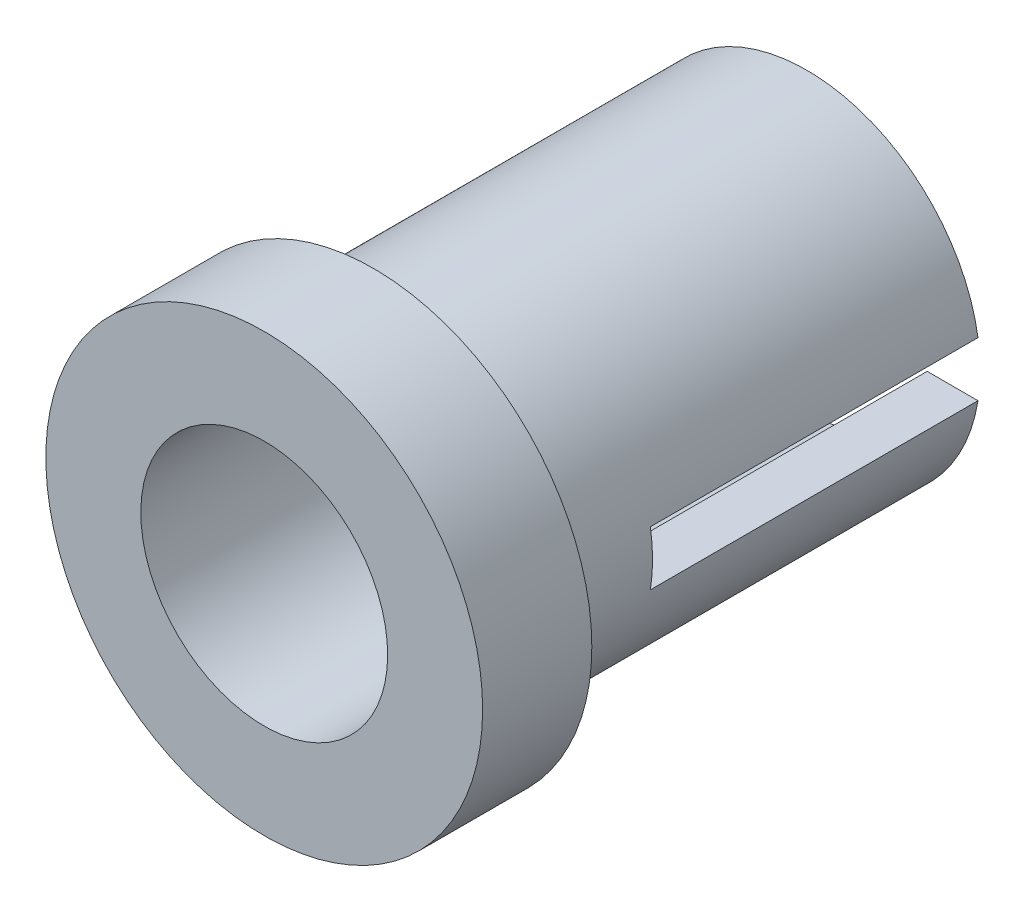
from build123d import *

# Parameters (mm, degrees)
SKETCH1_R           = 1.5875
SKETCH1_R_2         = 1.1303
BOSS_EXTRUDE1_DEPTH = 3.96875
SKETCH2_R           = 2
SKETCH2_R_2         = 1.5875
SKETCH2_R_3         = 1.1303
BOSS_EXTRUDE2_DEPTH = 1
SKETCH3_W           = 4.285117224
SKETCH3_H           = 0.5
CUT_EXTRUDE1_DEPTH  = 3


with BuildPart() as part:
    # Sketch1 → Boss-Extrude1 (new body)
    with BuildSketch(Plane.XY):
        Circle(SKETCH1_R)
        Circle(SKETCH1_R_2, mode=Mode.SUBTRACT)
    extrude(amount=BOSS_EXTRUDE1_DEPTH)

    # Sketch2 → Boss-Extrude2 (add)
    # profile 1 of 2: a face of its own
    with BuildSketch(Plane.XY.offset(3.96875)):
        Circle(SKETCH2_R)
        Circle(SKETCH2_R_2, mode=Mode.SUBTRACT)
    # profile 2 of 2: a face of its own
    with BuildSketch(Plane.XY.offset(3.96875)):
        Circle(SKETCH2_R_2)
        Circle(SKETCH2_R_3, mode=Mode.SUBTRACT)
    extrude(amount=BOSS_EXTRUDE2_DEPTH)

    # Sketch3 → Cut-Extrude1 (cut)
    with BuildSketch(Plane(origin=(0, 0, 0), x_dir=(-1, 0, 0), z_dir=(0, 0, -1))):
        Rectangle(SKETCH3_W, SKETCH3_H)
    extrude(amount=-CUT_EXTRUDE1_DEPTH, mode=Mode.SUBTRACT)


solid = part.part
